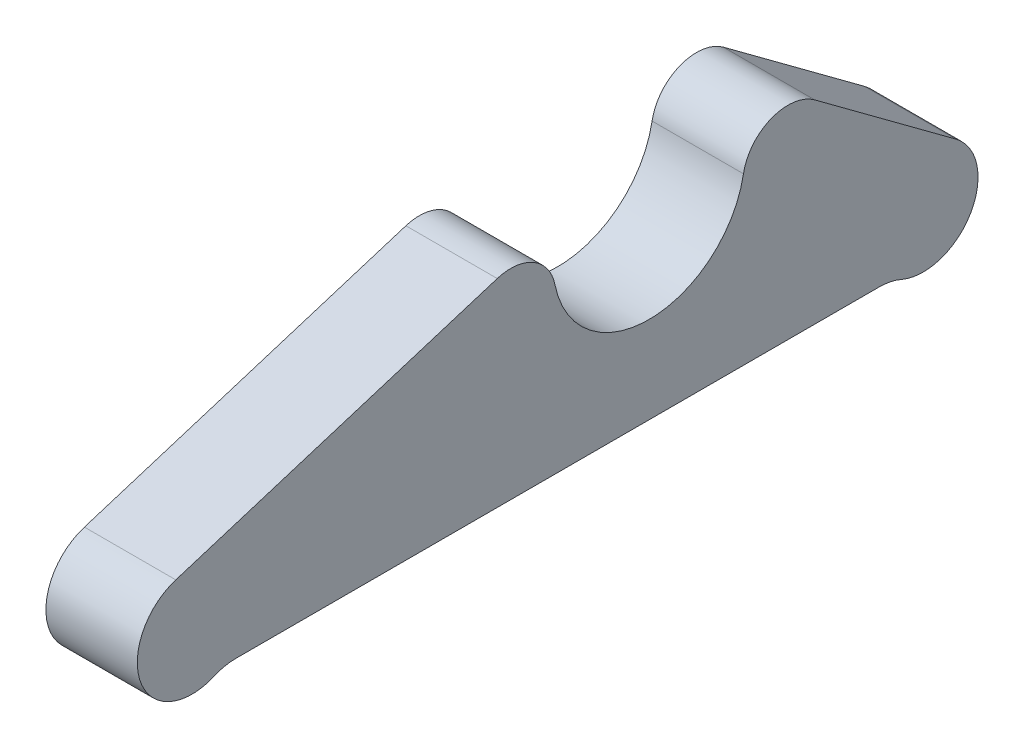
from build123d import *

# Parameters (mm, degrees)
BOSS_EXTRUDE1_DEPTH = 10


with BuildPart() as part:
    # Sketch1 → Boss-Extrude1 (new body)
    with BuildSketch(Plane(origin=(0, 0, 0), x_dir=(0, 0, -1), z_dir=(1, 0, 0))):
        with BuildLine():
            Line((-45.204168477, -20), (25.204168477, -20))
            ThreePointArc((25.204168477, -20), (26.428913348, -20.126329938), (27.602084238, -20.5))
            ThreePointArc((27.602084238, -20.5), (35.194165826, -18.003438259), (33.570567469, -10.178065953))
            Line((33.570567469, -10.178065953), (18.135704254, 1.251211168))
            ThreePointArc((18.135704254, 1.251211168), (13.371146439, 1.87224401), (10.33172294, -1.849126403))
            ThreePointArc((10.33172294, -1.849126403), (0.10386055, -10.495379), (-10.293105897, -2.053226328))
            ThreePointArc((-10.293105897, -2.053226328), (-12.616026385, 1.228698191), (-16.609464476, 1.697142804))
            Line((-16.609464476, 1.697142804), (-51.78615696, -9.272029739))
            ThreePointArc((-51.78615696, -9.272029739), (-55.622311914, -17.095139314), (-47.602084238, -20.5))
            ThreePointArc((-47.602084238, -20.5), (-46.428913348, -20.126329938), (-45.204168477, -20))
        make_face()
    extrude(amount=BOSS_EXTRUDE1_DEPTH)


solid = part.part
